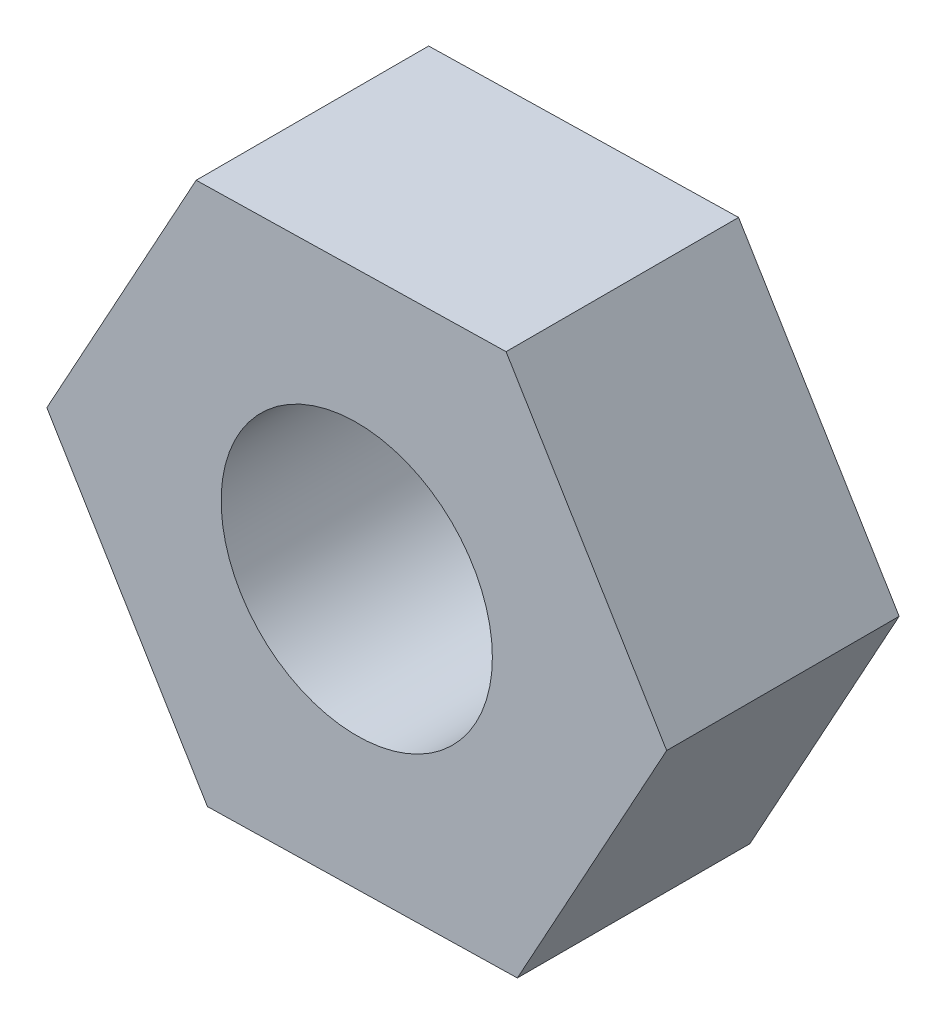
from build123d import *

# Parameters (mm, degrees)
SKETCH1_R           = 1.75
BOSS_EXTRUDE1_DEPTH = 3


with BuildPart() as part:
    # Sketch1 → Boss-Extrude1 (new body)
    with BuildSketch(Plane.XY):
        Polygon((1.926888048, 3.505296343), (-2.072231657, 3.421382171), (-3.999119705, -0.083914172), (-1.926888048, -3.505296343), (2.072231657, -3.421382171), (3.999119705, 0.083914172), align=None)
        Circle(SKETCH1_R, mode=Mode.SUBTRACT)
    extrude(amount=BOSS_EXTRUDE1_DEPTH)


solid = part.part
